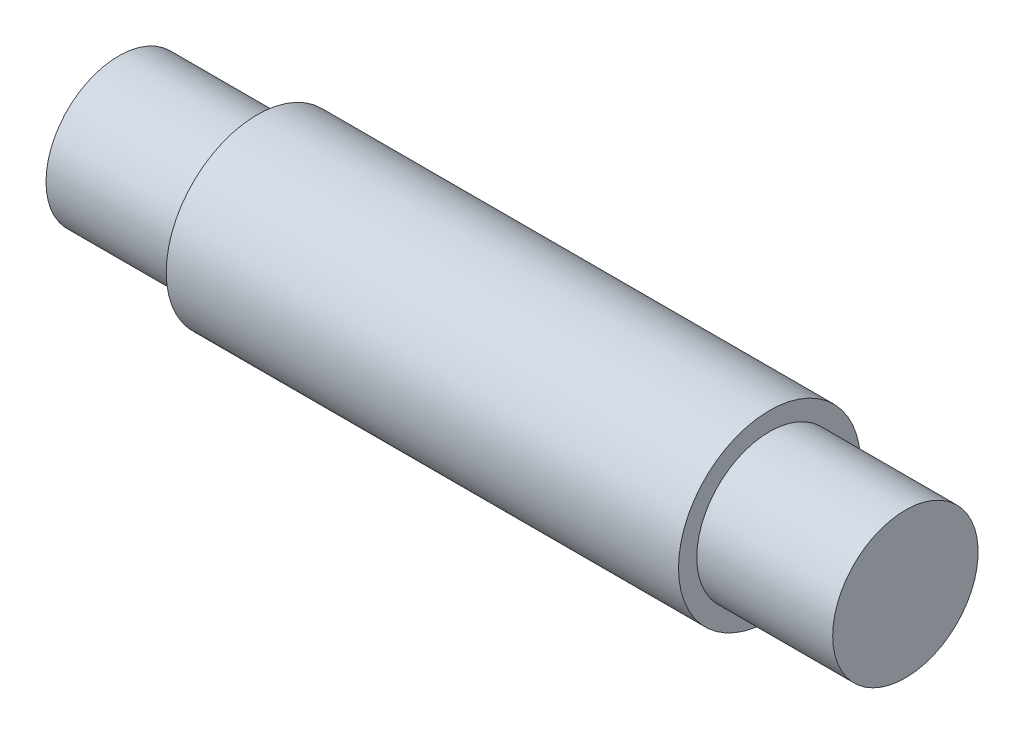
from build123d import *


with BuildPart() as part:
    # Croquis1 → Revolución1 (revolve)
    with BuildSketch(Plane.XY, mode=Mode.PRIVATE) as revoluci_n1_sk:
        Polygon((-43, 7.95), (-27.85778781, 7.95), (-27.85778781, 9.95), (28.14221219, 9.95), (28.14221219, 7.95), (43, 7.95), (43, 0), (-43, 0), align=None)
    revolve(revoluci_n1_sk.sketch.rotate(Axis((-43, 0, 0), (1, 0, 0)), 90), axis=Axis((-43, 0, 0), (1, 0, 0)))


solid = part.part
